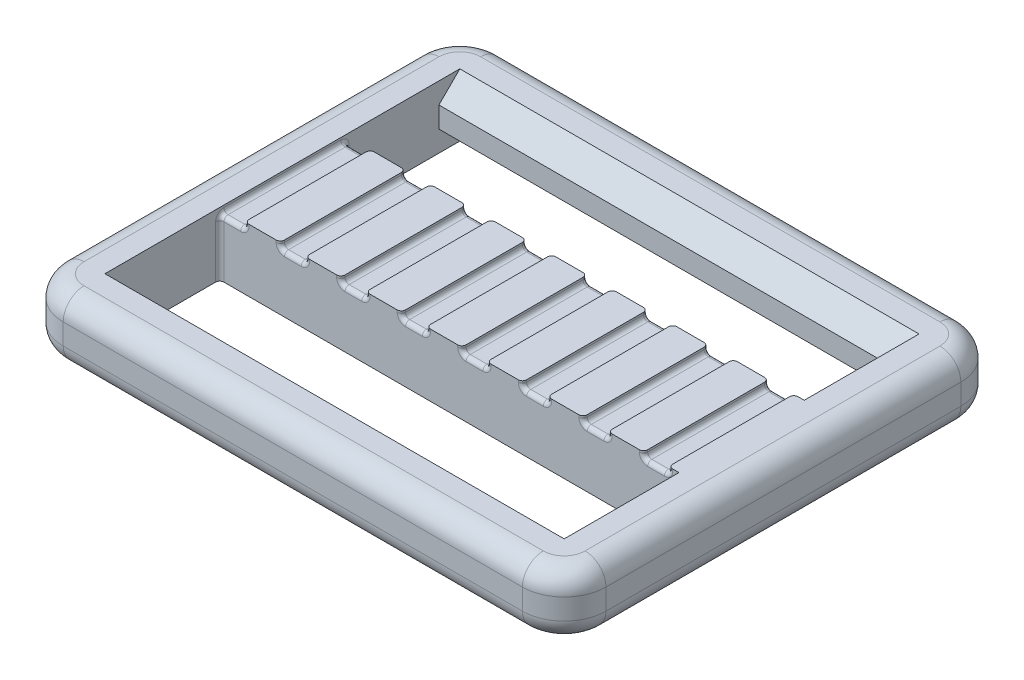
from build123d import *

# Parameters (mm, degrees)
SKETCH_1_W          = 22
SKETCH_1_H          = 4.5
EXTRUDE_1_DEPTH     = 3
SKETCH_3_W          = 1.2
SKETCH_3_H          = 6
CUT_EXTRUDE_1_DEPTH = 0.3
FILLET_1_R          = 0.2
CHAMFER_1_SIZE      = 1
FILLET_2_R          = 1


with BuildPart() as part:
    # 草图1 → 凸台-拉伸1 (new body)
    with BuildSketch(Plane(origin=(0, 0, 0), x_dir=(1, 0, 0), z_dir=(0, 1, 0))):
        with BuildLine():
            Line((-11, 10.5), (11, 10.5))
            ThreePointArc((11, 10.5), (12.414213562, 9.914213562), (13, 8.5))
            Line((13, 8.5), (13, -8.5))
            ThreePointArc((13, -8.5), (12.414213562, -9.914213562), (11, -10.5))
            Line((11, -10.5), (-11, -10.5))
            ThreePointArc((-11, -10.5), (-12.414213562, -9.914213562), (-13, -8.5))
            Line((-13, -8.5), (-13, 8.5))
            ThreePointArc((-13, 8.5), (-12.414213562, 9.914213562), (-11, 10.5))
        make_face()
        with Locations((0, -5.25)):
            Rectangle(SKETCH_1_W, SKETCH_1_H, mode=Mode.SUBTRACT)
        with Locations((0, 5.25)):
            Rectangle(SKETCH_1_W, SKETCH_1_H, mode=Mode.SUBTRACT)
    extrude(amount=EXTRUDE_1_DEPTH)

    # 草图3 → 切除-拉伸1 (cut)
    with BuildSketch(Plane(origin=(0, 3, 0), x_dir=(1, 0, 0), z_dir=(0, 1, 0))):
        with Locations((-10.4, 0)):
            Rectangle(SKETCH_3_W, SKETCH_3_H)
        with Locations((-7.5, 0)):
            Rectangle(SKETCH_3_W, SKETCH_3_H)
        with Locations((-4.6, 0)):
            Rectangle(SKETCH_3_W, SKETCH_3_H)
        with Locations((-1.7, 0)):
            Rectangle(SKETCH_3_W, SKETCH_3_H)
        with Locations((1.2, 0)):
            Rectangle(SKETCH_3_W, SKETCH_3_H)
        with Locations((4.1, 0)):
            Rectangle(SKETCH_3_W, SKETCH_3_H)
        with Locations((7, 0)):
            Rectangle(SKETCH_3_W, SKETCH_3_H)
        with Locations((9.9, 0)):
            Rectangle(SKETCH_3_W, SKETCH_3_H)
    extrude(amount=-CUT_EXTRUDE_1_DEPTH, mode=Mode.SUBTRACT)

    # 圆角1
    fillet_1_edges = [part.edges().sort_by_distance(p)[0] for p in [
        (-8.1, 2.7, 0),
        (-8.1, 2.85, 3),
        (-7.5, 2.7, -3),
        (-8.1, 2.85, -3),
        (-6.9, 2.7, 0),
        (-6.9, 2.85, -3),
        (-7.5, 2.7, 3),
        (-6.9, 2.85, 3),
        (-5.2, 2.7, 0),
        (-5.2, 2.85, 3),
        (-4.6, 2.7, -3),
        (-5.2, 2.85, -3),
        (-4, 2.7, 0),
        (-4, 2.85, -3),
        (-4.6, 2.7, 3),
        (-4, 2.85, 3),
        (-2.3, 2.7, 0),
        (-2.3, 2.85, 3),
        (-1.7, 2.7, -3),
        (-2.3, 2.85, -3),
        (-1.1, 2.7, 0),
        (-1.1, 2.85, -3),
        (-1.7, 2.7, 3),
        (-1.1, 2.85, 3),
        (0.6, 2.7, 0),
        (0.6, 2.85, 3),
        (1.2, 2.7, -3),
        (0.6, 2.85, -3),
        (1.8, 2.7, 0),
        (1.8, 2.85, -3),
        (1.2, 2.7, 3),
        (1.8, 2.85, 3),
        (3.5, 2.7, 0),
        (3.5, 2.85, 3),
        (4.1, 2.7, -3),
        (3.5, 2.85, -3),
        (4.7, 2.7, 0),
        (4.7, 2.85, -3),
        (4.1, 2.7, 3),
        (4.7, 2.85, 3),
        (6.4, 2.7, 0),
        (6.4, 2.85, 3),
        (7, 2.7, -3),
        (6.4, 2.85, -3),
        (7.6, 2.7, 0),
        (7.6, 2.85, -3),
        (7, 2.7, 3),
        (7.6, 2.85, 3),
        (9.3, 2.7, 0),
        (9.3, 2.85, 3),
        (9.9, 2.7, -3),
        (9.3, 2.85, -3),
        (10.5, 2.7, 0),
        (10.5, 2.85, -3),
        (9.9, 2.7, 3),
        (10.5, 2.85, 3),
        (-11, 1.35, 3),
        (-11, 1.35, -3),
        (-11, 2.7, 0),
        (-10.4, 2.7, -3),
        (-9.8, 2.7, 0),
        (-9.8, 2.85, -3),
        (-10.4, 2.7, 3),
        (-9.8, 2.85, 3),
    ]]
    fillet(fillet_1_edges, radius=FILLET_1_R)

    # 倒角1
    chamfer_1_edges = [part.edges().sort_by_distance(p)[0] for p in [
        (0, 0, -7.5),
        (0, 3, -7.5),
        (0, 0, 7.5),
        (0, 3, 7.5),
    ]]
    chamfer(chamfer_1_edges, length=CHAMFER_1_SIZE)

    # 圆角2
    fillet_2_edges = [part.edges().sort_by_distance(p)[0] for p in [
        (0, 0, -10.5),
        (12.414213562, 0, -9.914213562),
        (13, 0, 0),
        (12.414213562, 0, 9.914213562),
        (12.414213562, 3, -9.914213562),
        (0, 3, -10.5),
        (-12.414213562, 3, -9.914213562),
        (-13, 3, 0),
        (-12.414213562, 3, 9.914213562),
        (0, 3, 10.5),
        (12.414213562, 3, 9.914213562),
        (0, 0, 10.5),
        (13, 3, 0),
        (-12.414213562, 0, 9.914213562),
        (-13, 0, 0),
        (-12.414213562, 0, -9.914213562),
    ]]
    fillet(fillet_2_edges, radius=FILLET_2_R)


solid = part.part
